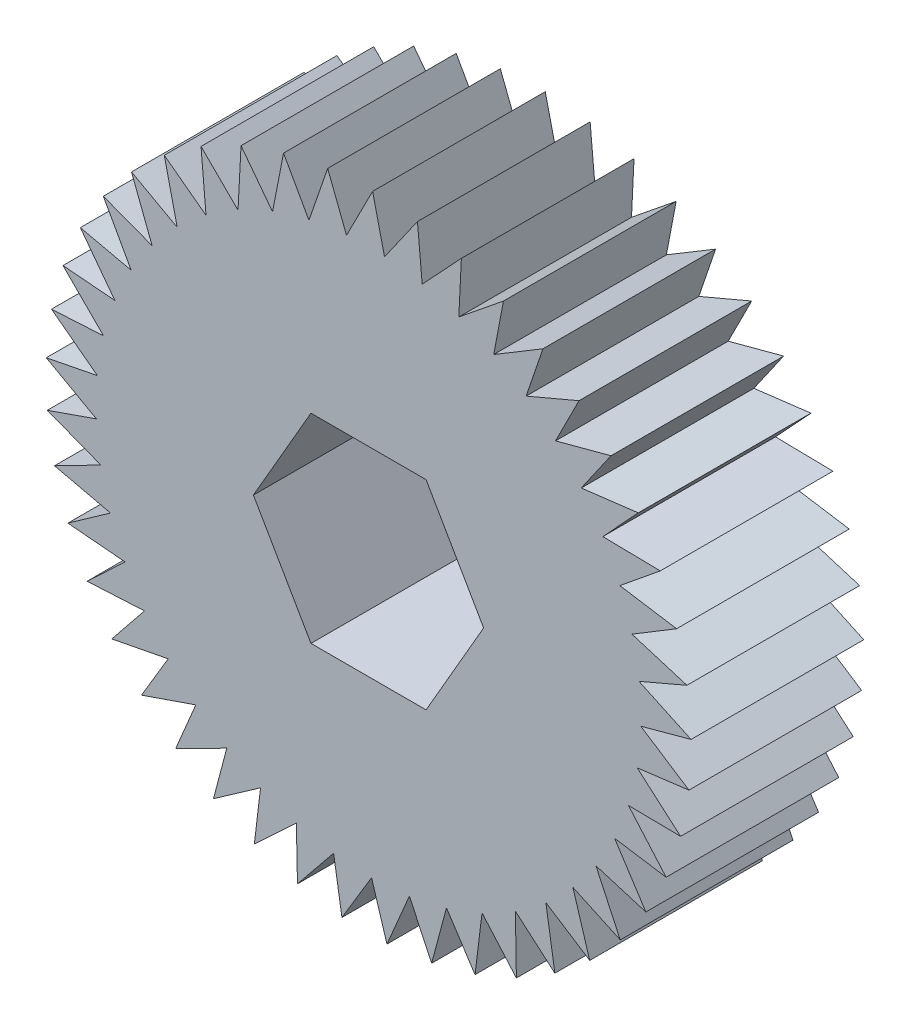
from build123d import *

# Parameters (mm, degrees)
SCHIZZO1_R                   = 34.641016151
ESTRUSIONE_ESTRUSIONE1_DEPTH = 7.5
TAGLIO_ESTRUSIONE1_DEPTH     = 52.23475383
RIPETIZIONECIRCOLARE1_COUNT  = 45


with BuildPart() as part:
    # Schizzo1 → Estrusione-Estrusione1 (new, symmetric)
    with BuildSketch(Plane.XY):
        Circle(SCHIZZO1_R)
        Polygon((10, 0), (5, 8.660254038), (-5, 8.660254038), (-10, 0), (-5, -8.660254038), (5, -8.660254038), align=None, mode=Mode.SUBTRACT)
    extrude(amount=ESTRUSIONE_ESTRUSIONE1_DEPTH, both=True)

    # Schizzo2 → Taglio-Estrusione1 (cut, through all)
    with BuildSketch(Plane.XY.offset(7.5)):
        Polygon((-6.551263351, 35.534227752), (-1.911546114, 23.580132753), (5.348246738, 37.826793916), align=None)
    taglio_estrusione1 = extrude(amount=-TAGLIO_ESTRUSIONE1_DEPTH, mode=Mode.SUBTRACT)

    # RipetizioneCircolare1: Taglio-Estrusione1 ×45 about axis
    ripetizionecircolare1_axis = Axis((0, 0, 0), (0, 0, 1))
    for i in range(1, RIPETIZIONECIRCOLARE1_COUNT):
        add(taglio_estrusione1.rotate(ripetizionecircolare1_axis, i * 360 / RIPETIZIONECIRCOLARE1_COUNT), mode=Mode.SUBTRACT)


solid = part.part
